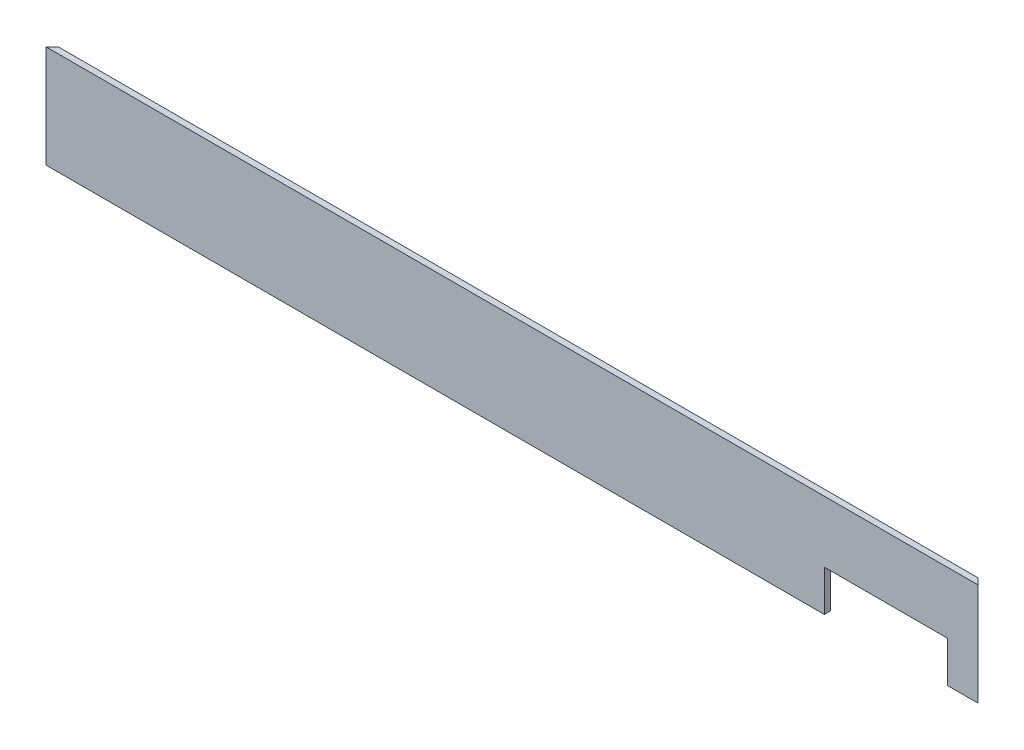
from build123d import *

# Parameters (mm, degrees)
SKETCH1_W           = 455
SKETCH1_H           = 3
BOSS_EXTRUDE1_DEPTH = 50
SKETCH2_W           = 60
SKETCH2_H           = 20
CUT_EXTRUDE1_DEPTH  = 55
CUT_EXTRUDE2_DEPTH  = 233.934540161


with BuildPart() as part:
    # Sketch1 → Boss-Extrude1 (new body)
    with BuildSketch(Plane(origin=(0, 0, 0), x_dir=(1, 0, 0), z_dir=(0, 1, 0))):
        Rectangle(SKETCH1_W, SKETCH1_H)
    extrude(amount=BOSS_EXTRUDE1_DEPTH)

    # Sketch2 → Cut-Extrude1 (cut)
    with BuildSketch(Plane.XY.offset(1.5)):
        with Locations((182.5, 10)):
            Rectangle(SKETCH2_W, SKETCH2_H)
    extrude(amount=-CUT_EXTRUDE1_DEPTH, mode=Mode.SUBTRACT)

    # Sketch3 → Cut-Extrude2 (cut, through all)
    with BuildSketch(Plane(origin=(0, 50, 0), x_dir=(1, 0, 0), z_dir=(0, 1, 0))):
        Polygon((-227.5, 1.5), (-227.5, -1.5), (-224.5, 1.5), align=None)
        Polygon((227.5, 1.5), (227.5, -1.5), (224.5, 1.5), align=None)
    extrude(amount=-CUT_EXTRUDE2_DEPTH, mode=Mode.SUBTRACT)


solid = part.part
